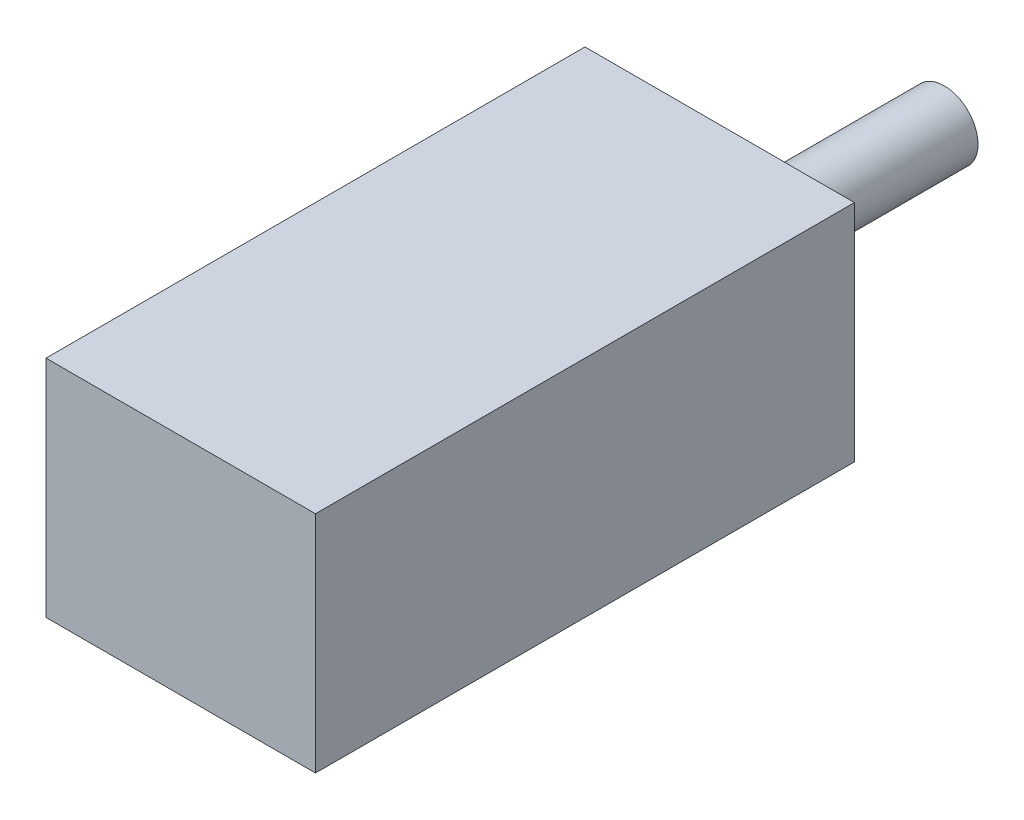
from build123d import *

# Parameters (mm, degrees)
SKETCH1_W           = 12
SKETCH1_H           = 10
BOSS_EXTRUDE1_DEPTH = 24
SKETCH2_R           = 1.5
BOSS_EXTRUDE2_DEPTH = 10


with BuildPart() as part:
    # Sketch1 → Boss-Extrude1 (new body)
    with BuildSketch(Plane.XY):
        Rectangle(SKETCH1_W, SKETCH1_H)
    extrude(amount=BOSS_EXTRUDE1_DEPTH)

    # Sketch2 → Boss-Extrude2 (add)
    with BuildSketch(Plane(origin=(0, 0, 0), x_dir=(-1, 0, 0), z_dir=(0, 0, -1))):
        with Locations(Location((0, 0, 0), (0, 0, 180))):
            Circle(SKETCH2_R)
    extrude(amount=BOSS_EXTRUDE2_DEPTH)


solid = part.part
